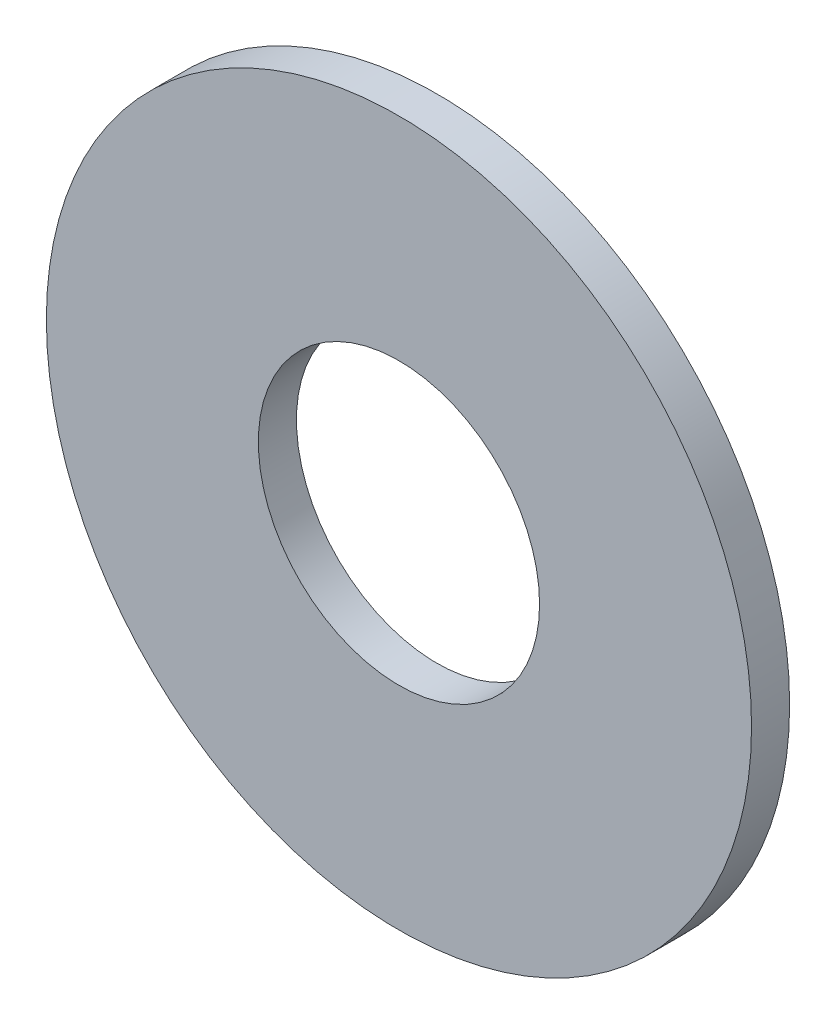
from build123d import *

# Parameters (mm, degrees)
SKETCH1_R      = 58.779736926
SKETCH1_R_2    = 23.441162592
EXTRUDE1_DEPTH = 6.35


with BuildPart() as part:
    # Sketch1 → Extrude1 (new body)
    with BuildSketch(Plane.XY):
        Circle(SKETCH1_R)
        Circle(SKETCH1_R_2, mode=Mode.SUBTRACT)
    extrude(amount=EXTRUDE1_DEPTH)


solid = part.part
